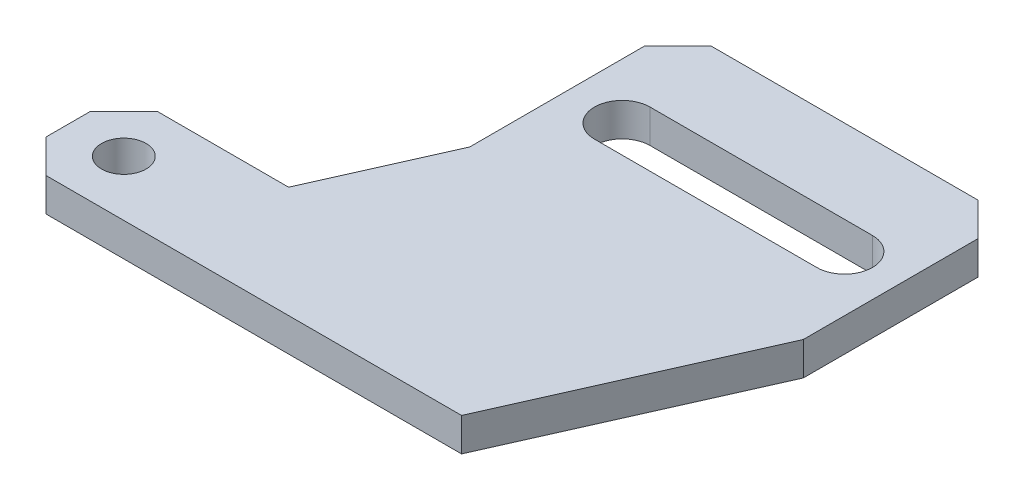
from build123d import *

# Parameters (mm, degrees)
CROQUIS1_R              = 2
SALIENTE_EXTRUIR1_DEPTH = 3
CHAFL_N1_SIZE           = 3


with BuildPart() as part:
    # Croquis1 → Saliente-Extruir1 (new body)
    with BuildSketch(Plane(origin=(0, 0, 0), x_dir=(1, 0, 0), z_dir=(0, 1, 0))):
        Polygon((-15, 11.288045039), (-15, 30), (15, 30), (15, 11.288045039), (5.54714751, -10), (-34.833084075, -10), (-34.833084075, 0), (-20.012401302, 0), align=None)
        with Locations(Location((-29.833084075, -5, 0), (0, 0, 270))):
            Circle(CROQUIS1_R, mode=Mode.SUBTRACT)
        with BuildLine():
            Line((-10, 17.5), (10, 17.5))
            ThreePointArc((10, 17.5), (12.5, 20), (10, 22.5))
            Line((10, 22.5), (-10, 22.5))
            ThreePointArc((-10, 22.5), (-12.5, 20), (-10, 17.5))
        make_face(mode=Mode.SUBTRACT)
    extrude(amount=SALIENTE_EXTRUIR1_DEPTH)

    # Chaflán1
    chafl_n1_edges = [part.edges().sort_by_distance(p)[0] for p in [
        (-34.833084075, 1.5, 10),
        (-34.833084075, 1.5, 0),
        (-15, 1.5, -30),
        (15, 1.5, -30),
    ]]
    chamfer(chafl_n1_edges, length=CHAFL_N1_SIZE)


solid = part.part
